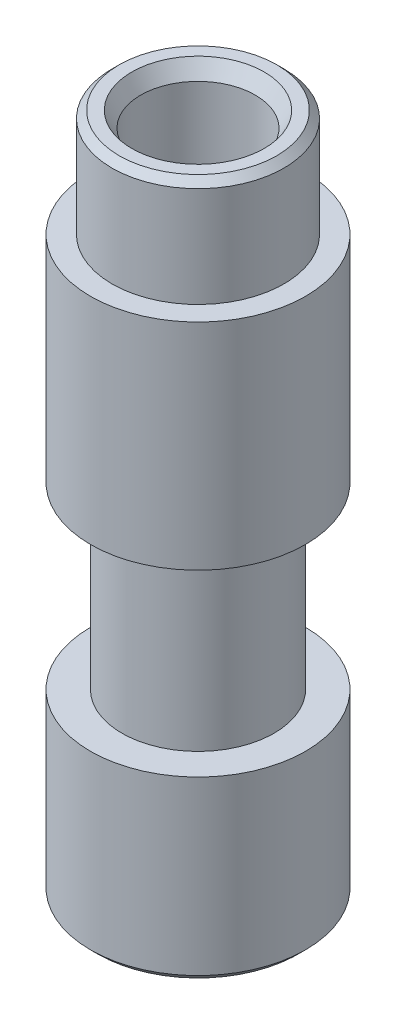
from build123d import *

# Parameters (mm, degrees)
CHAFL_N4_SIZE  = 0.2
CHAFL_N5_SIZE  = 0.25
CHAFL_N5_SIZE2 = 0.433012702


with BuildPart() as part:
    # Croquis3 → Revolución1 (revolve)
    with BuildSketch(Plane.XY, mode=Mode.PRIVATE) as revoluci_n1_sk:
        Polygon((-1.6, 0), (-1.6, 19), (-2.4, 19), (-2.4, 16), (-3, 16), (-3, 10), (-2.125, 10), (-2.125, 5), (-3, 5), (-3, 0), align=None)
    revolve(revoluci_n1_sk.sketch.rotate(Axis((0, 0, 0), (0, 1, 0)), 270), axis=Axis((0, 0, 0), (0, 1, 0)))

    # Chaflán4
    chafl_n4_edges = [part.edges().sort_by_distance(p)[0] for p in [
        (0, 19, 2.4),
        (0, 0, 3),
    ]]
    chamfer(chafl_n4_edges, length=CHAFL_N4_SIZE)

    # Chaflán5
    chafl_n5_edges = [part.edges().sort_by_distance(p)[0] for p in [
        (0, 19, 1.6),
    ]]
    chafl_n5_side = [part.faces().sort_by_distance(p)[0] for p in [
        (0, 19, 2.137774603),
    ]]
    chamfer(chafl_n5_edges, length=CHAFL_N5_SIZE, length2=CHAFL_N5_SIZE2, reference=chafl_n5_side[0])


solid = part.part
